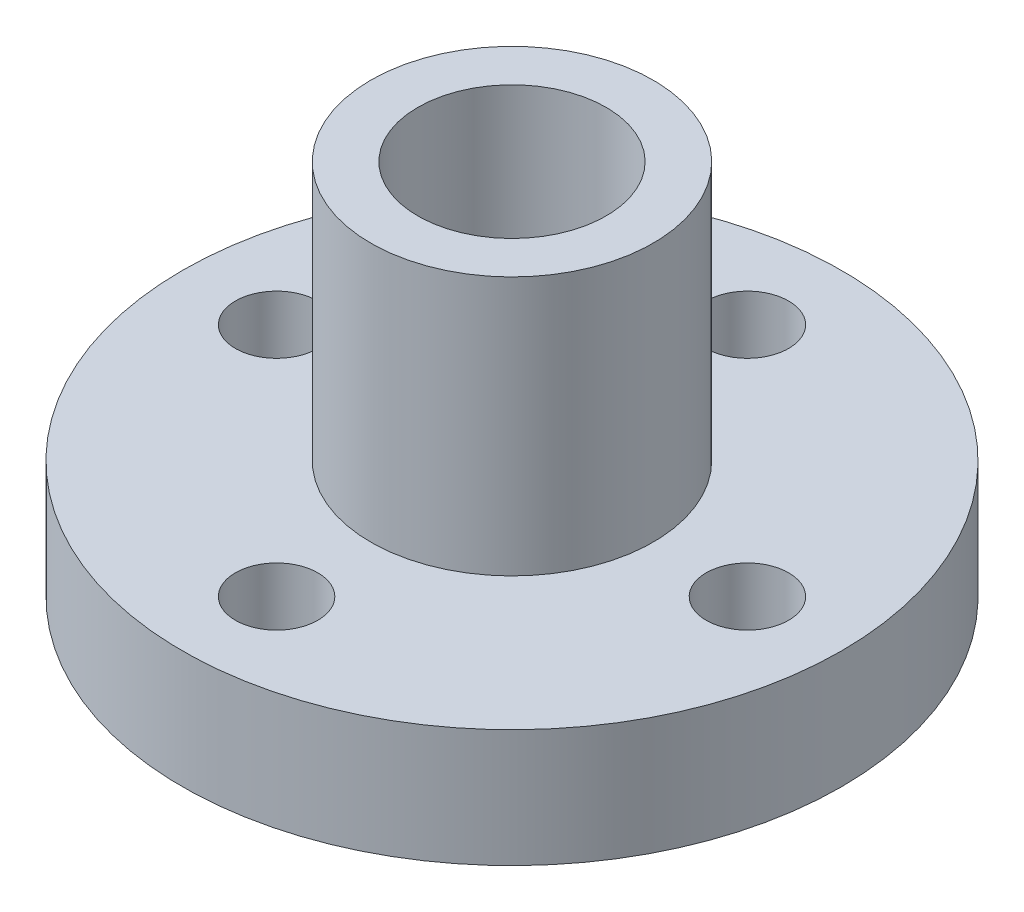
from build123d import *

# Parameters (mm, degrees)
SKETCH_2_R          = 1.75
CUT_EXTRUDE_1_DEPTH = 23.649503306


with BuildPart() as part:
    # 草图1 → 旋转1 (revolve)
    with BuildSketch(Plane.XY):
        Polygon((-4, -1.813333333), (-14, -1.813333333), (-14, 3.186666667), (-6, 3.186666667), (-6, 14.186666667), (-4, 14.186666667), align=None)
    revolve(axis=Axis((0, 8.12, 0), (0, -1, 0)))

    # 草图2 → 切除-拉伸1 (cut, through all)
    with BuildSketch(Plane(origin=(0, 3.186666667, 0), x_dir=(1, 0, 0), z_dir=(0, 1, 0))):
        with Locations(Location((0, 10, 0), (0, 0, 180))):
            Circle(SKETCH_2_R)
        with Locations(Location((10, 0, 0), (0, 0, 180))):
            Circle(SKETCH_2_R)
        with Locations(Location((0, -10, 0), (0, 0, 180))):
            Circle(SKETCH_2_R)
        with Locations(Location((-10, 0, 0), (0, 0, 180))):
            Circle(SKETCH_2_R)
    extrude(amount=-CUT_EXTRUDE_1_DEPTH, mode=Mode.SUBTRACT)


solid = part.part
